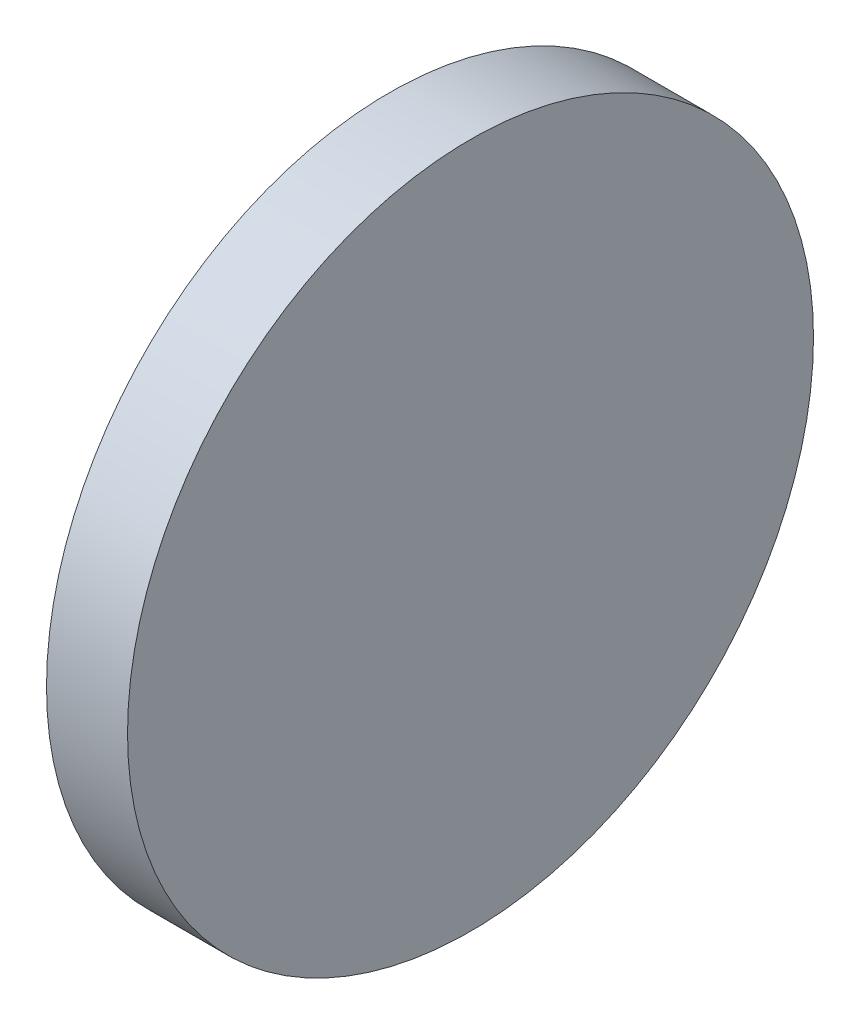
from build123d import *

# Parameters (mm, degrees)
AXIAL_PROFILE_MM_W = 6
AXIAL_PROFILE_MM_H = 25.4


with BuildPart() as part:
    # Axial profile (mm) → Full revolution (revolve)
    with BuildSketch(Plane.XY, mode=Mode.PRIVATE) as full_revolution_sk:
        with Locations((171.7, 12.7)):
            Rectangle(AXIAL_PROFILE_MM_W, AXIAL_PROFILE_MM_H)
    revolve(full_revolution_sk.sketch.rotate(Axis((-110, 0, 0), (1, 0, 0)), 90), axis=Axis((-110, 0, 0), (1, 0, 0)))


solid = part.part
